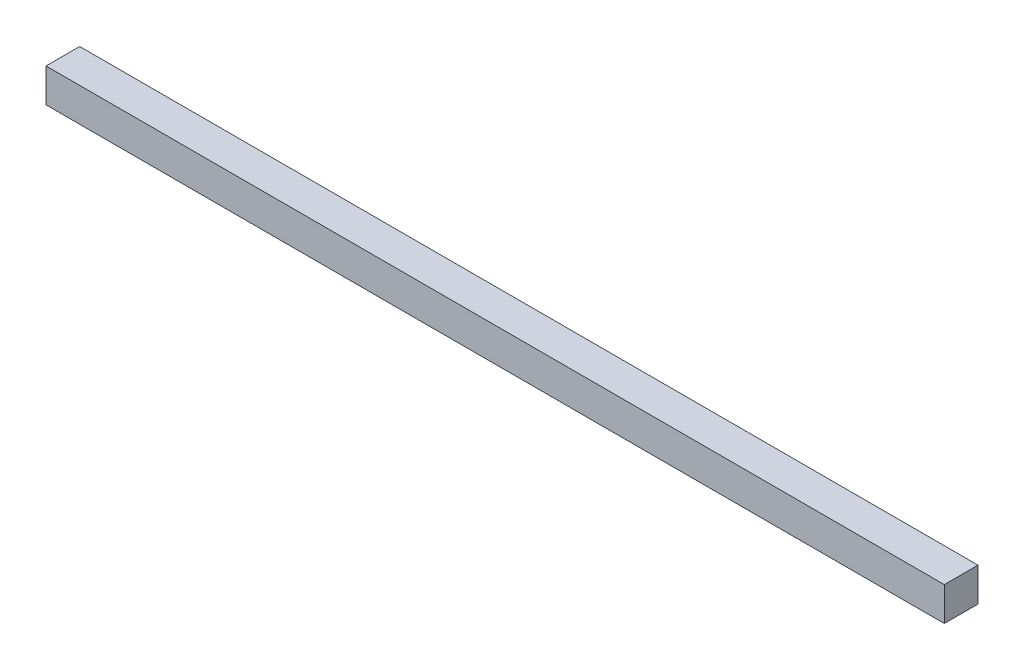
from build123d import *

# Parameters (mm, degrees)
SKETCH1_W           = 800
SKETCH1_H           = 30
BOSS_EXTRUDE1_DEPTH = 30


with BuildPart() as part:
    # Sketch1 → Boss-Extrude1 (new body)
    with BuildSketch(Plane(origin=(0, 0, 0), x_dir=(1, 0, 0), z_dir=(0, 1, 0))):
        with Locations((400, 15)):
            Rectangle(SKETCH1_W, SKETCH1_H)
    extrude(amount=BOSS_EXTRUDE1_DEPTH)


solid = part.part
